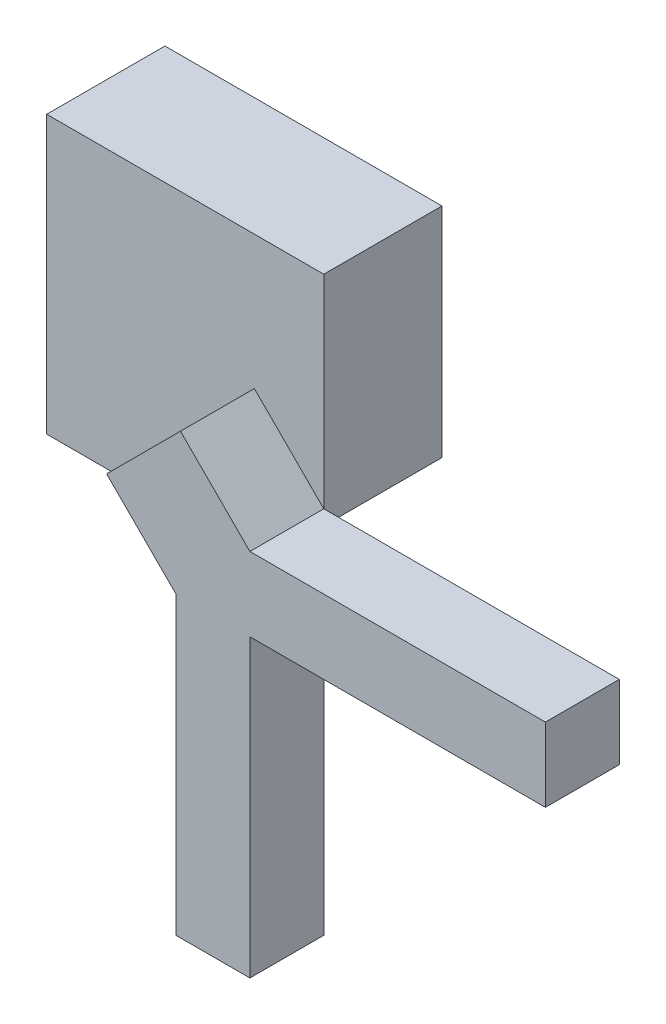
from build123d import *

# Parameters (mm, degrees)
BOSS_EXTRUDE1_DEPTH = 8
BOSS_EXTRUDE2_START = 8
BOSS_EXTRUDE2_DEPTH = 5
SKETCH5_W           = 4
SKETCH5_H           = 4
CUT_EXTRUDE1_DEPTH  = 8


with BuildPart() as part:
    # Sketch1 → Boss-Extrude1 (new body)
    with BuildSketch(Plane.XY):
        Polygon((9.375, -4.375), (9.375, -9.375), (4.375, -9.375), (-9.375, -9.375), (-9.375, 9.375), (9.375, 9.375), align=None)
    extrude(amount=BOSS_EXTRUDE1_DEPTH)

    # Sketch3 → Boss-Extrude2 (add)
    with BuildSketch(Plane.XY.offset(BOSS_EXTRUDE2_START)):
        Polygon((4.375, -9.375), (4.375, -29.375), (9.375, -29.375), (9.375, -9.375), (29.375, -9.375), (29.375, -4.375), (9.375, -4.375), (4.677094882, 0.322905118), (-0.322905118, -4.677094882), align=None)
    extrude(amount=BOSS_EXTRUDE2_DEPTH)

    # Sketch5 → Cut-Extrude1 (cut)
    with BuildSketch(Plane.XY):
        with Locations((7.375, -7.375)):
            Rectangle(SKETCH5_W, SKETCH5_H)
    extrude(amount=CUT_EXTRUDE1_DEPTH, mode=Mode.SUBTRACT)


solid = part.part
